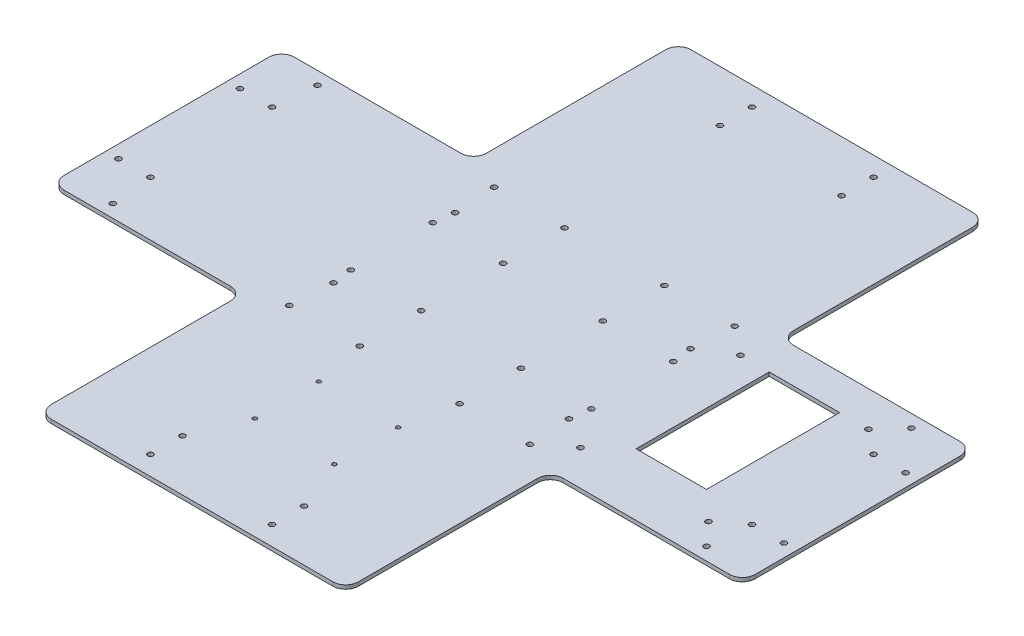
from build123d import *

# Parameters (mm, degrees)
BASE_DEPTH               = 3
FILLET1_R                = 10
SKETCH2_R                = 2.125
ARMOR_MODULE_HOLES_DEPTH = 3
SKETCH3_R                = 2.125
PLATES_FOR_GIMBAL_DEPTH  = 3
SKETCH6_R                = 2.125
SKETCH6_W                = 55
SKETCH6_H                = 104
BATTERY_MOUNT_DEPTH      = 10
SKETCH5_R                = 2.125
SUSPENSION_MOUNT_DEPTH   = 10
SKETCH7_R                = 2.125
OUTER_BOARD_MOUNT_DEPTH  = 10
SKETCH8_R                = 1.575
RFID_DEPTH               = 10


with BuildPart() as part:
    # Sketch1 → Base (new body)
    with BuildSketch(Plane(origin=(0, 0, 0), x_dir=(1, 0, 0), z_dir=(0, 1, 0))):
        Polygon((120, 250), (-120, 250), (-120, 90), (-270, 90), (-270, -90), (-120, -90), (-120, -250), (120, -250), (120, -90), (270, -90), (270, 90), (120, 90), align=None)
    extrude(amount=BASE_DEPTH)

    # Fillet1
    fillet1_edges = [part.edges().sort_by_distance(p)[0] for p in [
        (-270, 1.5, 90),
        (-270, 1.5, -90),
        (-120, 1.5, -90),
        (-120, 1.5, -250),
        (120, 1.5, -250),
        (120, 1.5, -90),
        (270, 1.5, -90),
        (270, 1.5, 90),
        (120, 1.5, 90),
        (120, 1.5, 250),
        (-120, 1.5, 250),
        (-120, 1.5, 90),
    ]]
    fillet(fillet1_edges, radius=FILLET1_R)

    # Sketch2 → Armor Module Holes (cut)
    with BuildSketch(Plane(origin=(0, 3, 0), x_dir=(1, 0, 0), z_dir=(0, 1, 0))):
        with Locations(Location((-47.5, 235, 0), (0, 0, 270))):
            Circle(SKETCH2_R)
        with Locations(Location((-47.5, 210, 0), (0, 0, 270))):
            Circle(SKETCH2_R)
        with Locations(Location((-260, 47.5, 0), (0, 0, 270))):
            Circle(SKETCH2_R)
        with Locations(Location((-235, 47.5, 0), (0, 0, 270))):
            Circle(SKETCH2_R)
        with Locations(Location((-235, -47.5, 0), (0, 0, 90))):
            Circle(SKETCH2_R)
        with Locations(Location((-260, -47.5, 0), (0, 0, 90))):
            Circle(SKETCH2_R)
        with Locations(Location((260, -47.5, 0), (0, 0, 270))):
            Circle(SKETCH2_R)
        with Locations(Location((235, -47.5, 0), (0, 0, 270))):
            Circle(SKETCH2_R)
        with Locations(Location((235, 47.5, 0), (0, 0, 90))):
            Circle(SKETCH2_R)
        with Locations(Location((260, 47.5, 0), (0, 0, 90))):
            Circle(SKETCH2_R)
        with Locations(Location((47.5, 210, 0), (0, 0, 90))):
            Circle(SKETCH2_R)
        with Locations(Location((47.5, 235, 0), (0, 0, 90))):
            Circle(SKETCH2_R)
        with Locations(Location((47.5, -235, 0), (0, 0, 270))):
            Circle(SKETCH2_R)
        with Locations(Location((47.5, -210, 0), (0, 0, 270))):
            Circle(SKETCH2_R)
        with Locations(Location((-47.5, -210, 0), (0, 0, 90))):
            Circle(SKETCH2_R)
        with Locations(Location((-47.5, -235, 0), (0, 0, 90))):
            Circle(SKETCH2_R)
    extrude(amount=-ARMOR_MODULE_HOLES_DEPTH, mode=Mode.SUBTRACT)

    # Sketch3 → Plates for Gimbal (cut)
    with BuildSketch(Plane(origin=(0, 3, 0), x_dir=(1, 0, 0), z_dir=(0, 1, 0))):
        with Locations(Location((92, 47.5, 0), (0, 0, 270))):
            Circle(SKETCH3_R)
        with Locations(Location((92, -47.5, 0), (0, 0, 90))):
            Circle(SKETCH3_R)
        with Locations(Location((-92, -47.5, 0), (0, 0, 270))):
            Circle(SKETCH3_R)
        with Locations(Location((-92, 47.5, 0), (0, 0, 90))):
            Circle(SKETCH3_R)
    extrude(amount=-PLATES_FOR_GIMBAL_DEPTH, mode=Mode.SUBTRACT)

    # Sketch6 → Battery Mount (cut)
    with BuildSketch(Plane(origin=(0, 3, 0), x_dir=(1, 0, 0), z_dir=(0, 1, 0))):
        with Locations(Location((116, -62.5, 0), (0, 0, 270))):
            Circle(SKETCH6_R)
        with Locations(Location((216, -62.5, 0), (0, 0, 270))):
            Circle(SKETCH6_R)
        with Locations(Location((216, 62.5, 0), (0, 0, 270))):
            Circle(SKETCH6_R)
        with Locations(Location((116, 62.5, 0), (0, 0, 270))):
            Circle(SKETCH6_R)
        with Locations((166, 10.5)):
            Rectangle(SKETCH6_W, SKETCH6_H)
    extrude(amount=-BATTERY_MOUNT_DEPTH, mode=Mode.SUBTRACT)

    # Sketch5 → Suspension Mount (cut)
    with BuildSketch(Plane(origin=(0, 3, 0), x_dir=(1, 0, 0), z_dir=(0, 1, 0))):
        with Locations(Location((94, -32, 0), (0, 0, 270))):
            Circle(SKETCH5_R)
        with Locations(Location((94, -80, 0), (0, 0, 270))):
            Circle(SKETCH5_R)
        with Locations(Location((39, -32, 0), (0, 0, 270))):
            Circle(SKETCH5_R)
        with Locations(Location((39, -80, 0), (0, 0, 270))):
            Circle(SKETCH5_R)
        with Locations(Location((-39, -80, 0), (0, 0, 270))):
            Circle(SKETCH5_R)
        with Locations(Location((-39, -32, 0), (0, 0, 270))):
            Circle(SKETCH5_R)
        with Locations(Location((-94, -80, 0), (0, 0, 270))):
            Circle(SKETCH5_R)
        with Locations(Location((-94, -32, 0), (0, 0, 270))):
            Circle(SKETCH5_R)
        with Locations(Location((-94, 32, 0), (0, 0, 270))):
            Circle(SKETCH5_R)
        with Locations(Location((-94, 80, 0), (0, 0, 270))):
            Circle(SKETCH5_R)
        with Locations(Location((-39, 32, 0), (0, 0, 270))):
            Circle(SKETCH5_R)
        with Locations(Location((-39, 80, 0), (0, 0, 270))):
            Circle(SKETCH5_R)
        with Locations(Location((39, 80, 0), (0, 0, 270))):
            Circle(SKETCH5_R)
        with Locations(Location((39, 32, 0), (0, 0, 270))):
            Circle(SKETCH5_R)
        with Locations(Location((94, 80, 0), (0, 0, 270))):
            Circle(SKETCH5_R)
        with Locations(Location((94, 32, 0), (0, 0, 270))):
            Circle(SKETCH5_R)
    extrude(amount=-SUSPENSION_MOUNT_DEPTH, mode=Mode.SUBTRACT)

    # Sketch7 → Outer Board Mount (cut)
    with BuildSketch(Plane(origin=(0, 3, 0), x_dir=(1, 0, 0), z_dir=(0, 1, 0))):
        with Locations(Location((-232, -80, 0), (0, 0, 270))):
            Circle(SKETCH7_R)
        with Locations(Location((-232, 80, 0), (0, 0, 270))):
            Circle(SKETCH7_R)
        with Locations(Location((232, 80, 0), (0, 0, 270))):
            Circle(SKETCH7_R)
        with Locations(Location((232, -80, 0), (0, 0, 270))):
            Circle(SKETCH7_R)
    extrude(amount=-OUTER_BOARD_MOUNT_DEPTH, mode=Mode.SUBTRACT)

    # Sketch8 → RFID (cut)
    with BuildSketch(Plane(origin=(0, 3, 0), x_dir=(1, 0, 0), z_dir=(0, 1, 0))):
        with Locations(Location((-31, -120, 0), (0, 0, 270))):
            Circle(SKETCH8_R)
        with Locations(Location((-31, -170, 0), (0, 0, 270))):
            Circle(SKETCH8_R)
        with Locations(Location((31, -170, 0), (0, 0, 270))):
            Circle(SKETCH8_R)
        with Locations(Location((31, -120, 0), (0, 0, 270))):
            Circle(SKETCH8_R)
    extrude(amount=-RFID_DEPTH, mode=Mode.SUBTRACT)


solid = part.part
